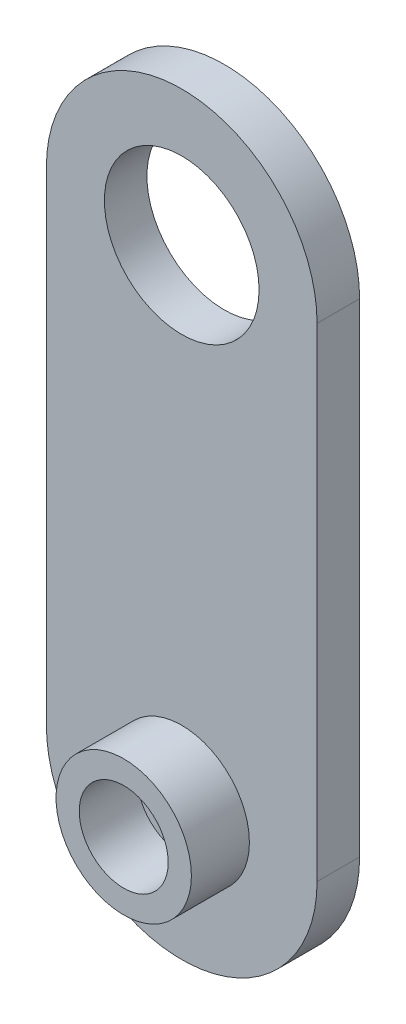
from build123d import *

# Parameters (mm, degrees)
CROQUIS1_R              = 1.1
SALIENTE_EXTRUIR1_DEPTH = 2.2
CROQUIS2_R              = 3.5
CROQUIS2_R_2            = 2.3
SALIENTE_EXTRUIR2_DEPTH = 3
CROQUIS3_R              = 2.25
CORTAR_EXTRUIR1_DEPTH   = 1


with BuildPart() as part:
    # Croquis1 → Saliente-Extruir1 (new body)
    with BuildSketch(Plane.XY):
        with BuildLine():
            Line((-7, 25), (-7, 0))
            ThreePointArc((-7, 0), (0, -7), (7, 0))
            Line((7, 0), (7, 25))
            ThreePointArc((7, 25), (0, 32), (-7, 25))
        make_face()
        Circle(CROQUIS1_R, mode=Mode.SUBTRACT)
        with BuildLine():
            ThreePointArc((4, 25), (0, 29), (-4, 25))
            ThreePointArc((-4, 25), (0, 21), (4, 25))
        make_face(mode=Mode.SUBTRACT)
    extrude(amount=SALIENTE_EXTRUIR1_DEPTH)

    # Croquis2 → Saliente-Extruir2 (add)
    with BuildSketch(Plane.XY.offset(2.2)):
        Circle(CROQUIS2_R)
        Circle(CROQUIS2_R_2, mode=Mode.SUBTRACT)
    extrude(amount=SALIENTE_EXTRUIR2_DEPTH)

    # Croquis3 → Cortar-Extruir1 (cut)
    with BuildSketch(Plane(origin=(0, 0, 0), x_dir=(-1, 0, 0), z_dir=(0, 0, -1))):
        Circle(CROQUIS3_R)
    extrude(amount=-CORTAR_EXTRUIR1_DEPTH, mode=Mode.SUBTRACT)


solid = part.part
